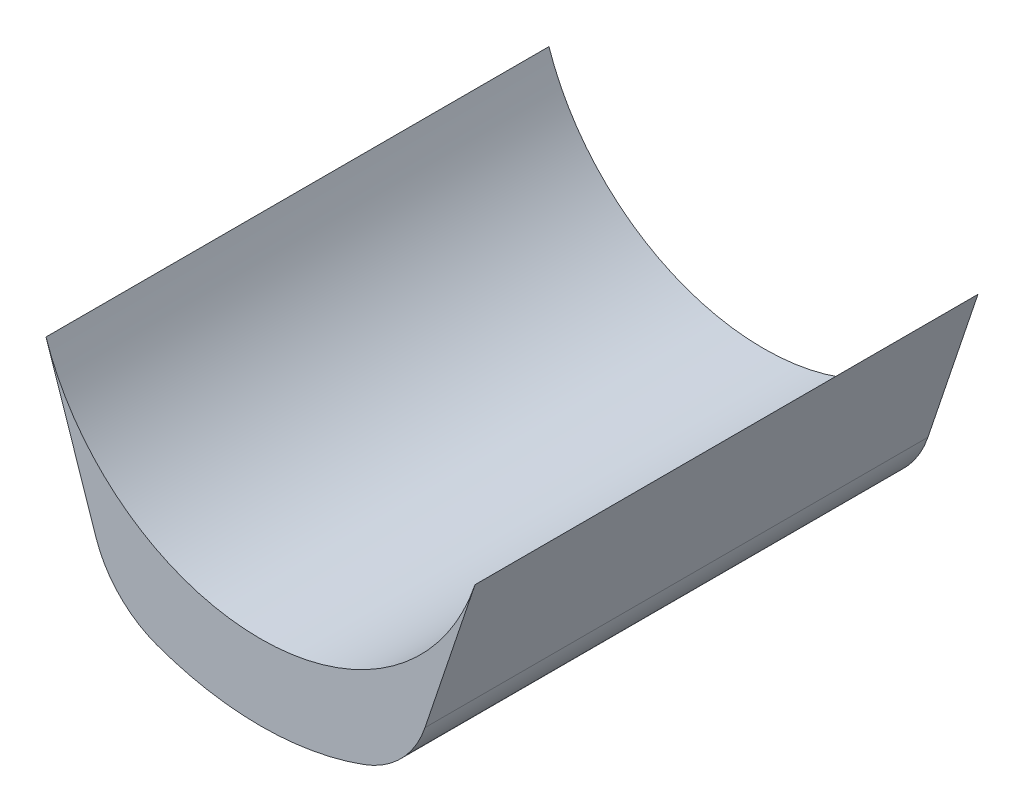
from build123d import *

# Parameters (mm, degrees)
BOSS_EXTRUDE1_DEPTH = 127
FILLET1_R           = 25.4


with BuildPart() as part:
    # Sketch2 → Boss-Extrude1 (new body)
    with BuildSketch(Plane.XY):
        with BuildLine():
            Line((-54.168025121, -18.219427941), (-38.1, -65.991135768))
            ThreePointArc((-38.1, -65.991135768), (0, -76.2), (38.1, -65.991135768))
            Line((38.1, -65.991135768), (54.168025121, -18.219427941))
            ThreePointArc((54.168025121, -18.219427941), (0, -57.15), (-54.168025121, -18.219427941))
        make_face()
    extrude(amount=BOSS_EXTRUDE1_DEPTH)

    # Fillet1
    fillet1_edges = [part.edges().sort_by_distance(p)[0] for p in [
        (38.1, -65.991135768, 63.5),
        (-38.1, -65.991135768, 63.5),
    ]]
    fillet(fillet1_edges, radius=FILLET1_R)


solid = part.part
